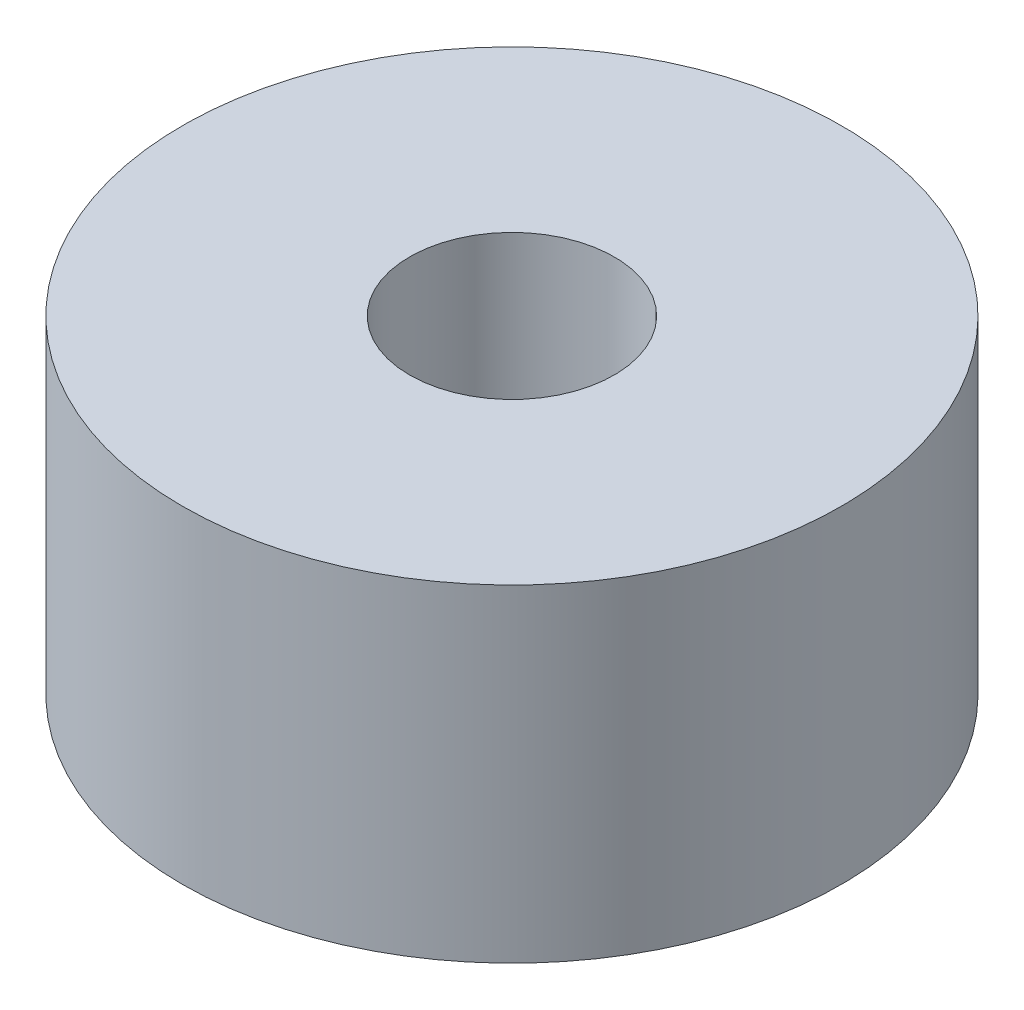
from build123d import *

# Parameters (mm, degrees)
SKETCH1_R           = 16.1
BOSS_EXTRUDE1_DEPTH = 16
SKETCH2_R           = 5
CUT_EXTRUDE1_DEPTH  = 28.828402757


with BuildPart() as part:
    # Sketch1 → Boss-Extrude1 (new body)
    with BuildSketch(Plane(origin=(0, 0, 0), x_dir=(1, 0, 0), z_dir=(0, 1, 0))):
        with Locations(Location((0, 0, 0), (0, 0, 270))):
            Circle(SKETCH1_R)
    extrude(amount=BOSS_EXTRUDE1_DEPTH)

    # Sketch2 → Cut-Extrude1 (cut, through all)
    with BuildSketch(Plane(origin=(0, 16, 0), x_dir=(1, 0, 0), z_dir=(0, 1, 0))):
        with Locations(Location((0, 0, 0), (0, 0, 270))):
            Circle(SKETCH2_R)
    extrude(amount=-CUT_EXTRUDE1_DEPTH, mode=Mode.SUBTRACT)


solid = part.part
